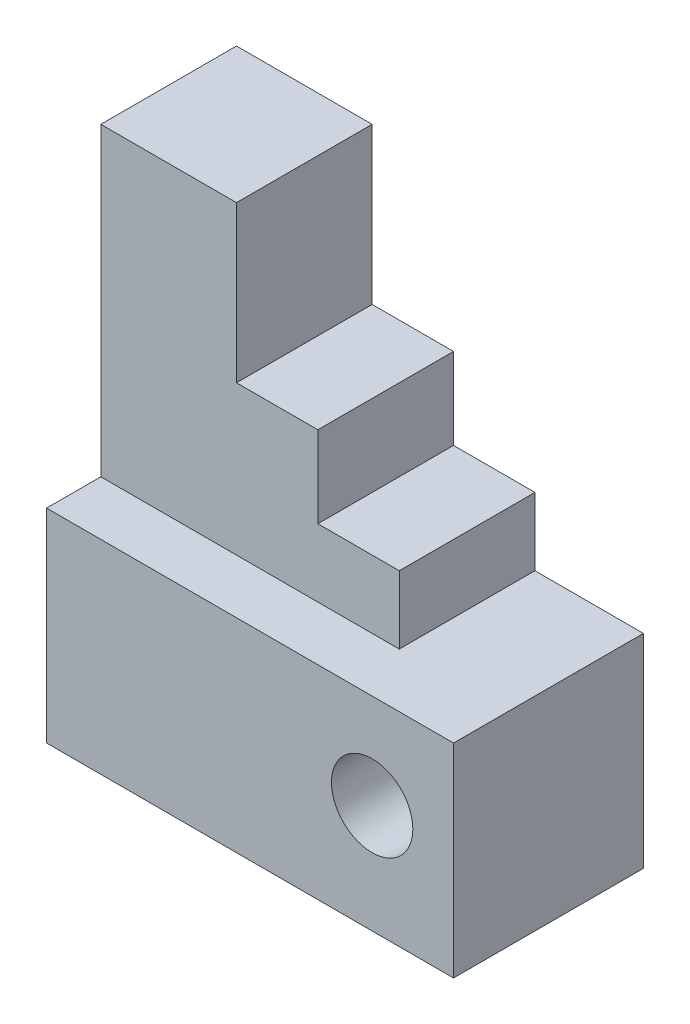
from build123d import *

# Parameters (mm, degrees)
SKETCH1_W           = 60
SKETCH1_H           = 30
SKETCH1_R           = 6
BOSS_EXTRUDE1_DEPTH = 28
BOSS_EXTRUDE3_DEPTH = 20


with BuildPart() as part:
    # Sketch1 → Boss-Extrude1 (new body)
    with BuildSketch(Plane.XY):
        with Locations((-18, -1)):
            Rectangle(SKETCH1_W, SKETCH1_H)
        Circle(SKETCH1_R, mode=Mode.SUBTRACT)
    extrude(amount=BOSS_EXTRUDE1_DEPTH)

    # Sketch4 → Boss-Extrude3 (add)
    with BuildSketch(Plane(origin=(0, 0, 0), x_dir=(-1, 0, 0), z_dir=(0, 0, -1))):
        Polygon((48, 14), (48, 59), (28, 59), (28, 36), (16, 36), (16, 24), (4, 24), (4, 14), align=None)
    extrude(amount=-BOSS_EXTRUDE3_DEPTH)


solid = part.part
